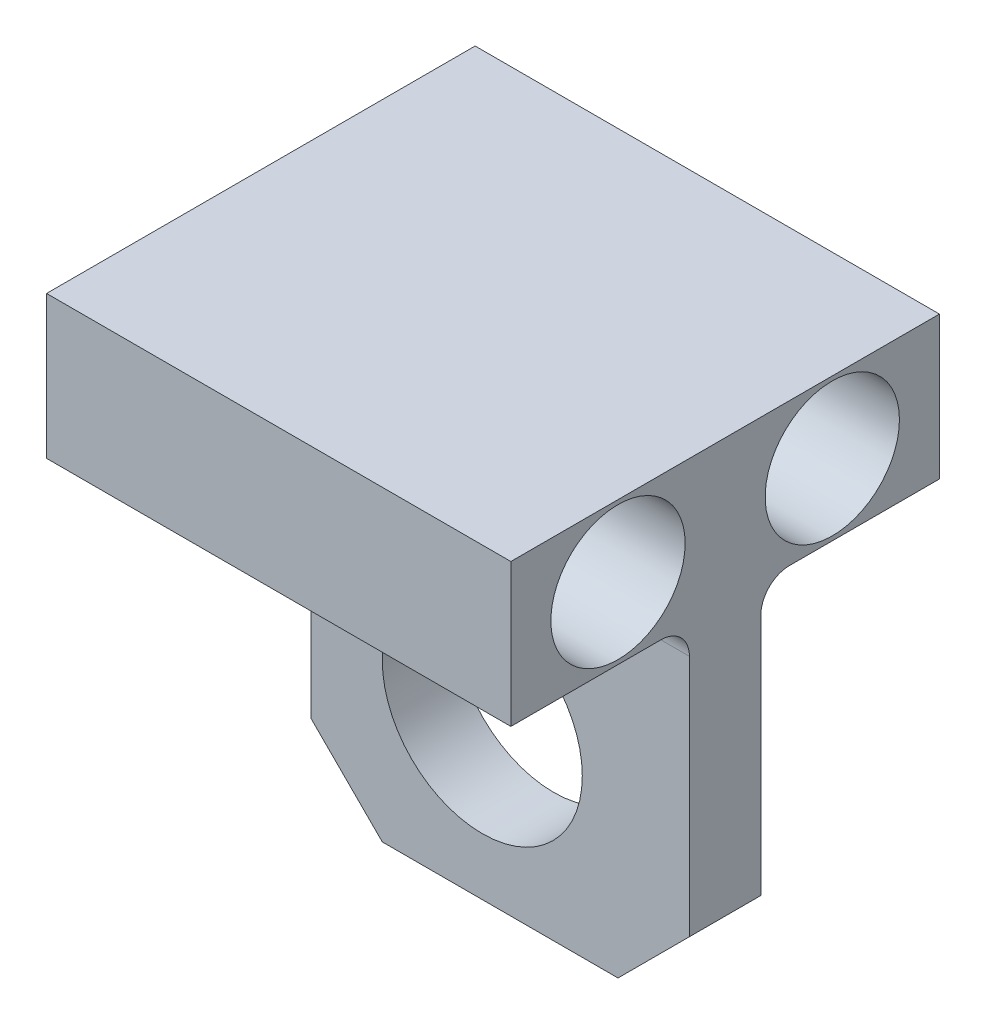
from build123d import *

# Parameters (mm, degrees)
SKETCH_1_W                  = 30
SKETCH_1_H                  = 34
EXTRUDE_1_DEPTH             = 16.25
SKETCH_2_W                  = 12.5
SKETCH_2_H                  = 24
CUT_EXTRUDE_1_DEPTH         = 40.626380102
SKETCH_5_W                  = 6
SKETCH_5_H                  = 24
CUT_EXTRUDE_2_DEPTH         = 49.521258228
HOLE_WIZARD_1_D             = 14
HOLE_WIZARD_1_2_D           = 5.5
HOLE_WIZARD_1_2_CBORE_D     = 9.4
HOLE_WIZARD_1_2_CBORE_DEPTH = 7
FILLET_1_R                  = 2
CHAMFER_1_SIZE              = 5


with BuildPart() as part:
    # 草图1 → 凸台-拉伸1 (new, symmetric)
    with BuildSketch(Plane(origin=(0, 0, 0), x_dir=(0, 0, -1), z_dir=(1, 0, 0))):
        Rectangle(SKETCH_1_W, SKETCH_1_H)
    extrude(amount=EXTRUDE_1_DEPTH, both=True)

    # 草图2 → 切除-拉伸1 (cut, through all)
    with BuildSketch(Plane(origin=(16.25, 0, 0), x_dir=(0, 0, -1), z_dir=(1, 0, 0))):
        with Locations((8.75, -5)):
            Rectangle(SKETCH_2_W, SKETCH_2_H)
        with Locations((-8.75, -5)):
            Rectangle(SKETCH_2_W, SKETCH_2_H)
    extrude(amount=-CUT_EXTRUDE_1_DEPTH, mode=Mode.SUBTRACT)

    # 草图5 → 切除-拉伸2 (cut, through all)
    with BuildSketch(Plane(origin=(0, 17.5, -15), x_dir=(1, 0, 0), z_dir=(0, 0, 1))):
        with Locations((-13.25, -22.5)):
            Rectangle(SKETCH_5_W, SKETCH_5_H)
    extrude(amount=CUT_EXTRUDE_2_DEPTH, mode=Mode.SUBTRACT)

    # Hole Wizard 1 (through all)
    with Locations(Plane.XY.offset(15)):
        with Locations((1.75, -6)):
            Hole(HOLE_WIZARD_1_D / 2)

    # Hole Wizard 1 2 (through all)
    with Locations(Plane(origin=(16.25, 0, 0), x_dir=(0, 0, -1), z_dir=(1, 0, 0))):
        with Locations((7.5, 12), (-7.5, 12)):
            CounterBoreHole(HOLE_WIZARD_1_2_D / 2, HOLE_WIZARD_1_2_CBORE_D / 2, HOLE_WIZARD_1_2_CBORE_DEPTH)

    # 圆角1
    fillet_1_edges = [part.edges().sort_by_distance(p)[0] for p in [
        (3, 7, 2.5),
        (3, 7, -2.5),
    ]]
    fillet(fillet_1_edges, radius=FILLET_1_R)

    # 倒角1
    chamfer_1_edges = [part.edges().sort_by_distance(p)[0] for p in [
        (16.25, -17, 0),
        (-10.25, -17, 0),
    ]]
    chamfer(chamfer_1_edges, length=CHAMFER_1_SIZE)


solid = part.part
